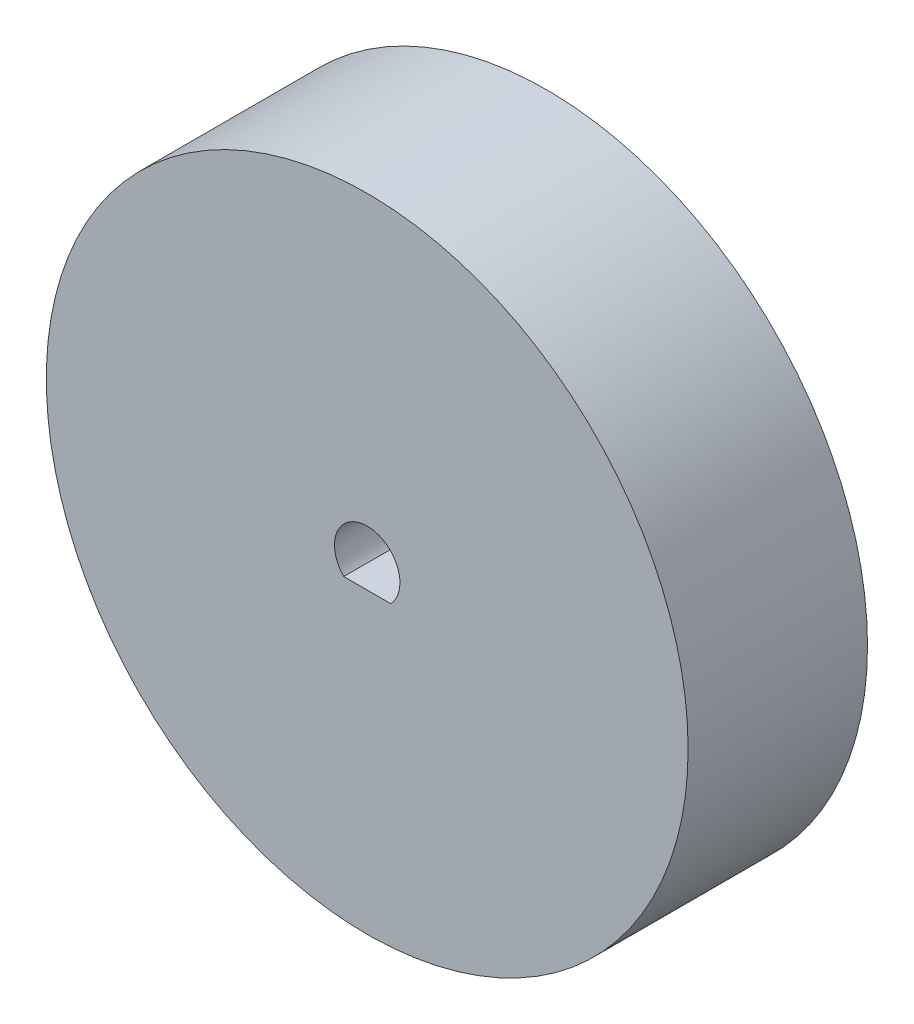
from build123d import *

# Parameters (mm, degrees)
SKETCH1_R           = 16.1
BOSS_EXTRUDE1_DEPTH = 9


with BuildPart() as part:
    # Sketch1 → Boss-Extrude1 (new body)
    with BuildSketch(Plane.XY):
        Circle(SKETCH1_R)
        with BuildLine():
            Line((-1.178982612, -1.14), (1.178982612, -1.14))
            ThreePointArc((1.178982612, -1.14), (0, 1.64), (-1.178982612, -1.14))
        make_face(mode=Mode.SUBTRACT)
    extrude(amount=BOSS_EXTRUDE1_DEPTH)


solid = part.part
